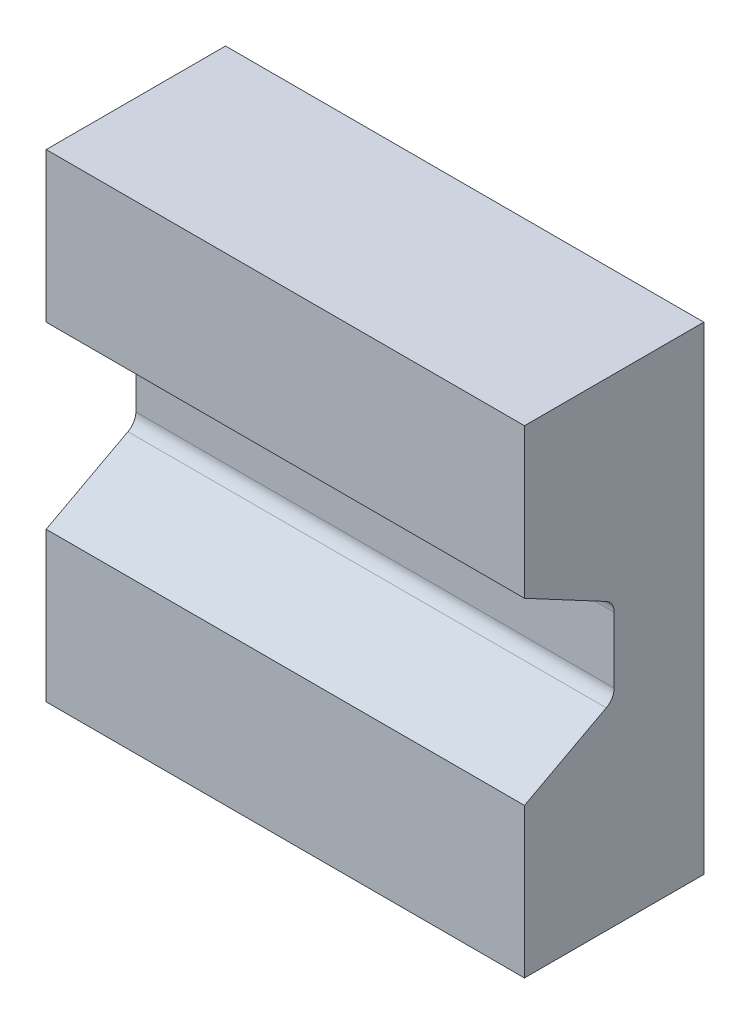
from build123d import *

# Parameters (mm, degrees)
CROQUIS1_W              = 80
CROQUIS1_H              = 80
SALIENTE_EXTRUIR1_DEPTH = 30
CORTAR_EXTRUIR1_DEPTH   = 95.339811321


with BuildPart() as part:
    # Croquis1 → Saliente-Extruir1 (new body)
    with BuildSketch(Plane.XY):
        Rectangle(CROQUIS1_W, CROQUIS1_H)
    extrude(amount=SALIENTE_EXTRUIR1_DEPTH)

    # Croquis2 → Cortar-Extruir1 (cut, through all)
    with BuildSketch(Plane(origin=(40, 0, 0), x_dir=(0, 0, -1), z_dir=(1, 0, 0))):
        with BuildLine():
            Line((-30, 15), (-16.323529412, 7.705882353))
            ThreePointArc((-16.323529412, 7.705882353), (-15.356267686, 6.786239389), (-15, 5.5))
            Line((-15, 5.5), (-15, -5.5))
            ThreePointArc((-15, -5.5), (-15.356267686, -6.786239389), (-16.323529412, -7.705882353))
            Line((-16.323529412, -7.705882353), (-30, -15))
            Line((-30, -15), (-30, 15))
        make_face()
    extrude(amount=-CORTAR_EXTRUIR1_DEPTH, mode=Mode.SUBTRACT)


solid = part.part
